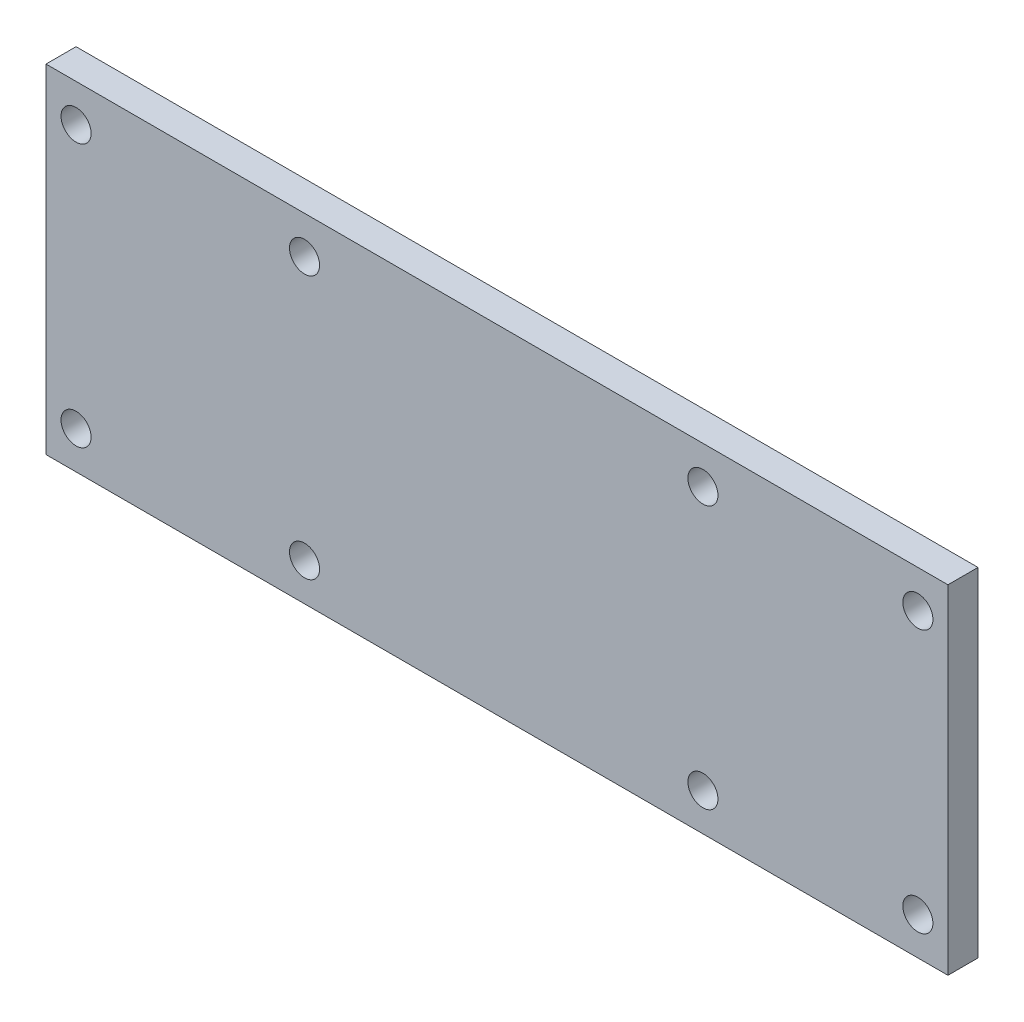
from build123d import *

# Parameters (mm, degrees)
ESQUISSE1_W        = 120
ESQUISSE1_H        = 45
ESQUISSE1_R        = 2
BOSS_EXTRU_1_DEPTH = 4


with BuildPart() as part:
    # Esquisse1 → Boss.-Extru.1 (new body)
    with BuildSketch(Plane.XY):
        Rectangle(ESQUISSE1_W, ESQUISSE1_H)
        with Locations((56, -17.5)):
            Circle(ESQUISSE1_R, mode=Mode.SUBTRACT)
        with Locations((27.4, -17.5)):
            Circle(ESQUISSE1_R, mode=Mode.SUBTRACT)
        with Locations((-25.6, -17.5)):
            Circle(ESQUISSE1_R, mode=Mode.SUBTRACT)
        with Locations((-56, -17.5)):
            Circle(ESQUISSE1_R, mode=Mode.SUBTRACT)
        with Locations((-25.6, 17.5)):
            Circle(ESQUISSE1_R, mode=Mode.SUBTRACT)
        with Locations((27.4, 17.5)):
            Circle(ESQUISSE1_R, mode=Mode.SUBTRACT)
        with Locations((56, 17.5)):
            Circle(ESQUISSE1_R, mode=Mode.SUBTRACT)
        with Locations((-56, 17.5)):
            Circle(ESQUISSE1_R, mode=Mode.SUBTRACT)
    extrude(amount=BOSS_EXTRU_1_DEPTH)


solid = part.part
